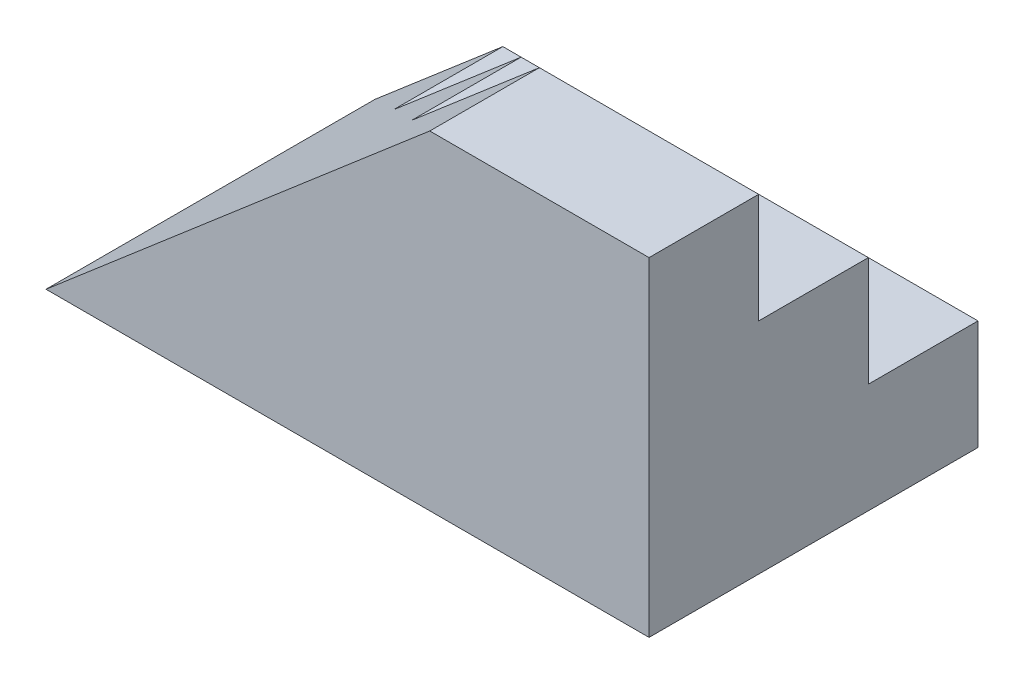
from build123d import *

# Parameters (mm, degrees)
SALIENTE_EXTRUIR2_DEPTH    = 110
CORTAR_EXTRUIR1_DEPTH      = 139.924439894
CORTAR_EXTRUIR1_DEPTH_BACK = 139.924439894


with BuildPart() as part:
    # Croquis1 → Saliente-Extruir2 (new body)
    with BuildSketch(Plane(origin=(0, 0, 0), x_dir=(0, 0, -1), z_dir=(1, 0, 0))):
        Polygon((0, 0), (60, 0), (60, 20), (40, 20), (40, 40), (20, 40), (20, 60), (0, 60), align=None)
    extrude(amount=SALIENTE_EXTRUIR2_DEPTH)

    # Croquis2 → Cortar-Extruir1 (cut, two sides: drawn at the far end of the back side and taken through both)
    with BuildSketch(Plane.XY.offset(-CORTAR_EXTRUIR1_DEPTH_BACK)):
        Polygon((-197.86172522, -169.595764474), (0, 0), (70, 60), (267.86172522, 229.595764474), (-71.329803728, 625.319214913), (-537.053254168, 226.127685965), align=None)
    extrude(amount=CORTAR_EXTRUIR1_DEPTH + CORTAR_EXTRUIR1_DEPTH_BACK, mode=Mode.SUBTRACT)


solid = part.part
